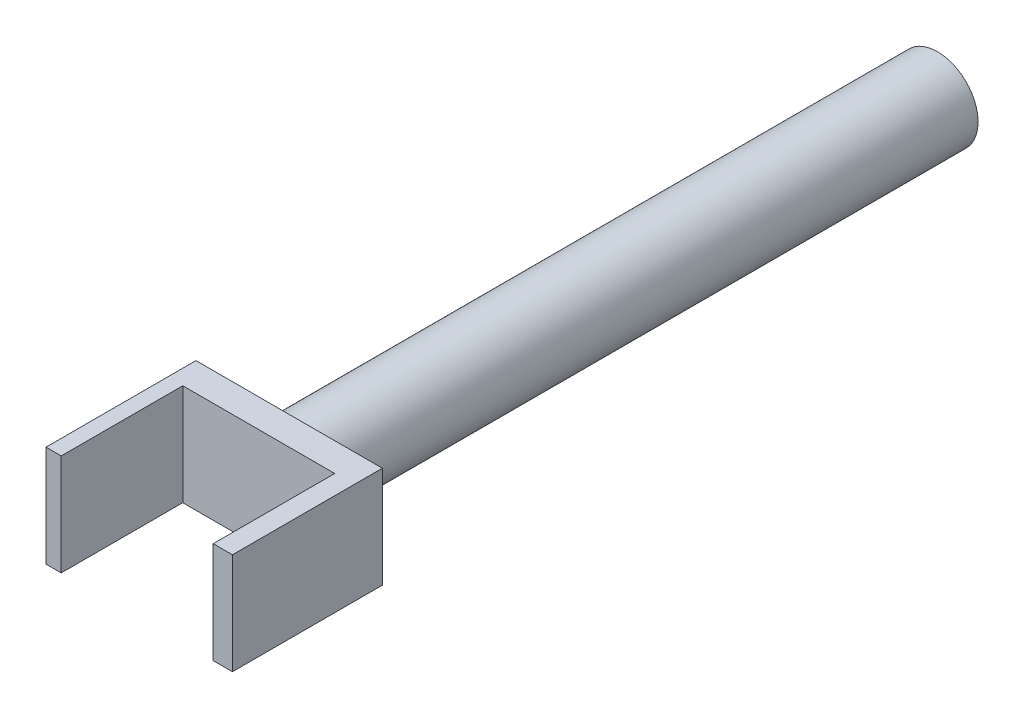
from build123d import *

# Parameters (mm, degrees)
SKETCH1_W           = 46
SKETCH1_H           = 25
BOSS_EXTRUDE1_DEPTH = 37
SKETCH2_R           = 10
BOSS_EXTRUDE2_DEPTH = 160
SKETCH3_W           = 37.5
SKETCH3_H           = 36.8
CUT_EXTRUDE1_DEPTH  = 30


with BuildPart() as part:
    # Sketch1 → Boss-Extrude1 (new body)
    with BuildSketch(Plane.XY):
        Rectangle(SKETCH1_W, SKETCH1_H)
    extrude(amount=-BOSS_EXTRUDE1_DEPTH)

    # Sketch2 → Boss-Extrude2 (add)
    with BuildSketch(Plane(origin=(0, 0, -37), x_dir=(-1, 0, 0), z_dir=(0, 0, -1))):
        Circle(SKETCH2_R)
    extrude(amount=BOSS_EXTRUDE2_DEPTH)

    # Sketch3 → Cut-Extrude1 (cut)
    with BuildSketch(Plane.XY):
        with Locations((-0.5, 0)):
            Rectangle(SKETCH3_W, SKETCH3_H)
    extrude(amount=-CUT_EXTRUDE1_DEPTH, mode=Mode.SUBTRACT)


solid = part.part
